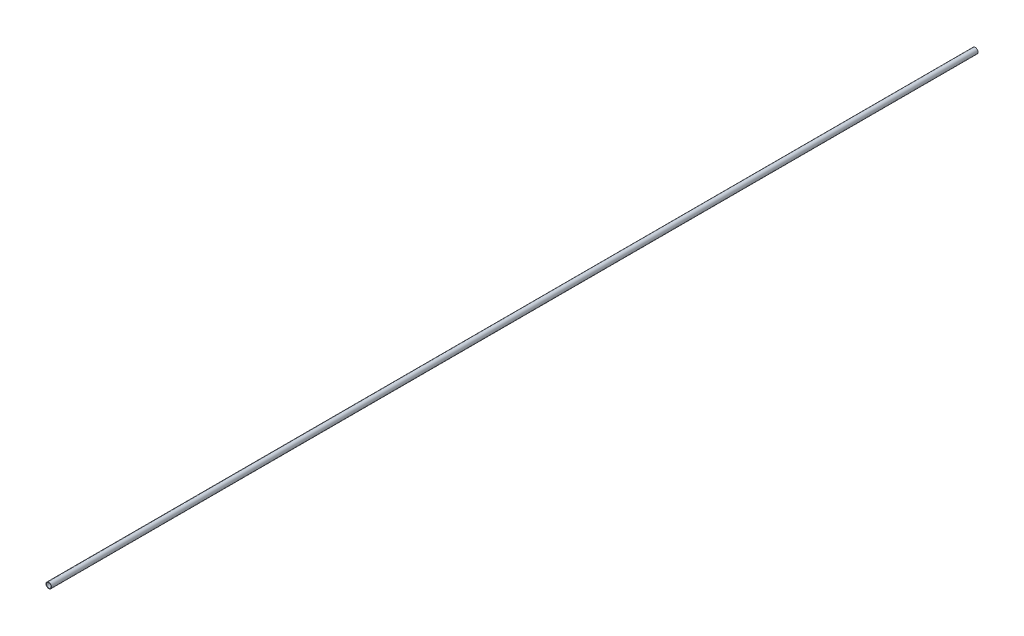
from build123d import *

# Parameters (mm, degrees)
SKETCH1_R           = 3
BOSS_EXTRUDE1_DEPTH = 500
SHELL1_T            = -0.5


with BuildPart() as part:
    # Sketch1 → Boss-Extrude1 (new, symmetric)
    with BuildSketch(Plane.XY):
        Circle(SKETCH1_R)
    extrude(amount=BOSS_EXTRUDE1_DEPTH, both=True)

    # Shell1
    shell1_openings = [part.faces().sort_by_distance(p)[0] for p in [
        (0, 0, 500),
        (0, 0, -500),
    ]]
    offset(amount=SHELL1_T, openings=shell1_openings, kind=Kind.INTERSECTION)


solid = part.part
